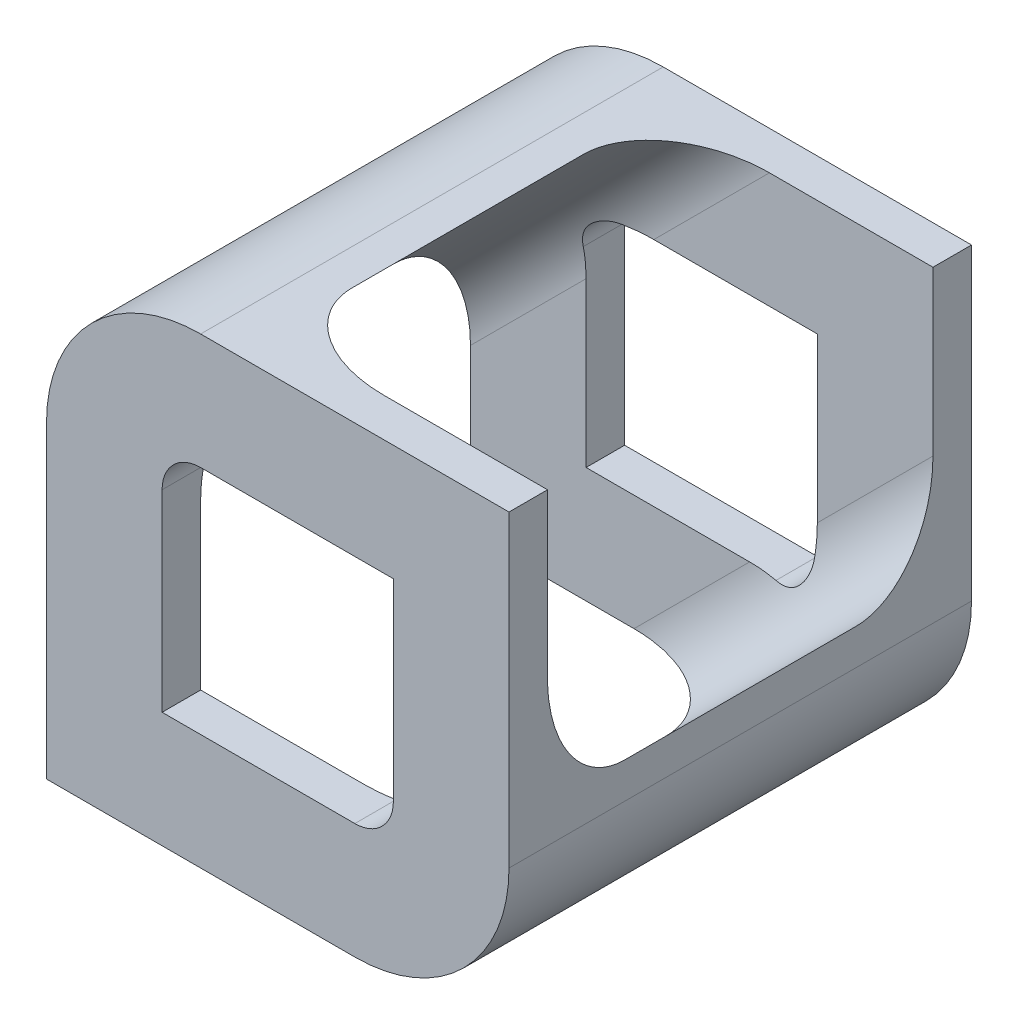
from build123d import *

# Parameters (mm, degrees)
BOSS_EXTRUDE5_DEPTH = 76.2
CUT_EXTRUDE1_DEPTH  = 133.458777786


with BuildPart() as part:
    # Sketch1 → Boss-Extrude5 (new body)
    with BuildSketch(Plane.XY):
        with BuildLine():
            Line((-57.15, -41.275), (-6.35, -41.275))
            ThreePointArc((-6.35, -41.275), (11.610512242, -33.835512242), (19.05, -15.875))
            Line((19.05, -15.875), (19.05, 34.925))
            Line((19.05, 34.925), (-31.75, 34.925))
            ThreePointArc((-31.75, 34.925), (-49.710512242, 27.485512242), (-57.15, 9.525))
            Line((-57.15, 9.525), (-57.15, -41.275))
        make_face()
        with BuildLine():
            Line((-38.1, -22.225), (-6.35, -22.225))
            ThreePointArc((-6.35, -22.225), (-1.859871939, -20.365128061), (0, -15.875))
            Line((0, -15.875), (0, 15.875))
            Line((0, 15.875), (-31.75, 15.875))
            ThreePointArc((-31.75, 15.875), (-36.240128061, 14.015128061), (-38.1, 9.525))
            Line((-38.1, 9.525), (-38.1, -22.225))
        make_face(mode=Mode.SUBTRACT)
    extrude(amount=BOSS_EXTRUDE5_DEPTH)

    # Sketch5 → Cut-Extrude1 (cut, through all)
    with BuildSketch(Plane(origin=(26.9875, 26.9875, 0), x_dir=(0.7071067811865477, -0.7071067811865475, 0), z_dir=(0.7071067811865475, 0.7071067811865477, 0))):
        with BuildLine():
            Line((-30.275320151, -69.85), (7.824679849, -69.85))
            ThreePointArc((7.824679849, -69.85), (16.80493597, -66.130256121), (20.524679849, -57.15))
            Line((20.524679849, -57.15), (20.524679849, -19.05))
            ThreePointArc((20.524679849, -19.05), (16.80493597, -10.069743879), (7.824679849, -6.35))
            Line((7.824679849, -6.35), (-30.275320151, -6.35))
            ThreePointArc((-30.275320151, -6.35), (-39.255576272, -10.069743879), (-42.975320151, -19.05))
            Line((-42.975320151, -19.05), (-42.975320151, -57.15))
            ThreePointArc((-42.975320151, -57.15), (-39.255576272, -66.130256121), (-30.275320151, -69.85))
        make_face()
    extrude(amount=-CUT_EXTRUDE1_DEPTH, mode=Mode.SUBTRACT)


solid = part.part
